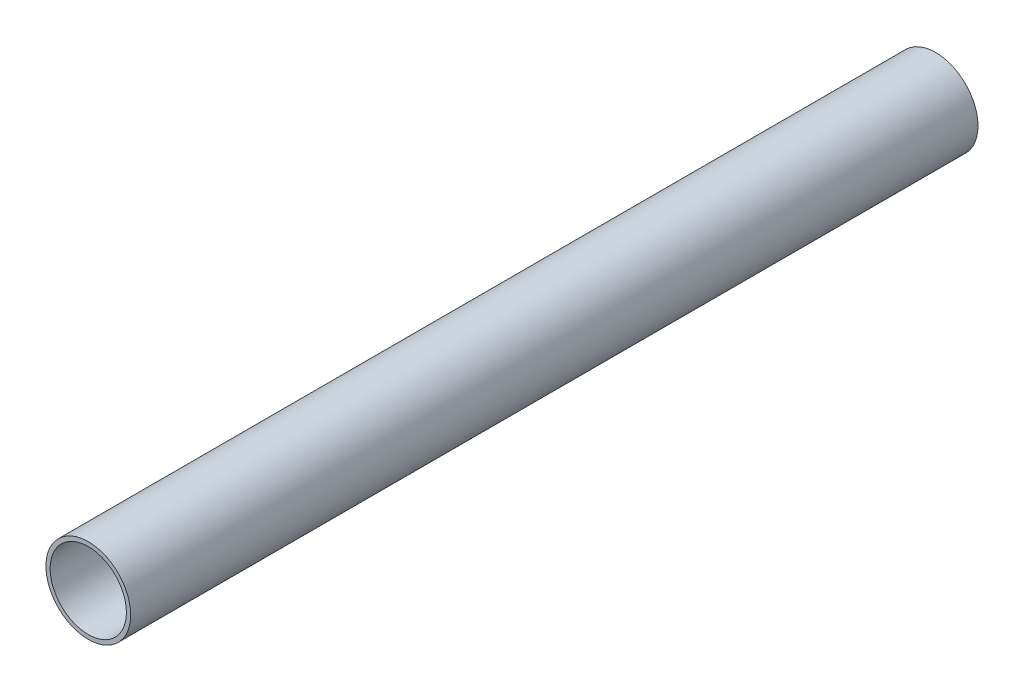
from build123d import *

# Parameters (mm, degrees)
SKETCH1_R           = 15
SKETCH1_R_2         = 13.5
BOSS_EXTRUDE1_DEPTH = 300


with BuildPart() as part:
    # Sketch1 → Boss-Extrude1 (new body)
    with BuildSketch(Plane.XY):
        Circle(SKETCH1_R)
        Circle(SKETCH1_R_2, mode=Mode.SUBTRACT)
    extrude(amount=BOSS_EXTRUDE1_DEPTH)


solid = part.part
